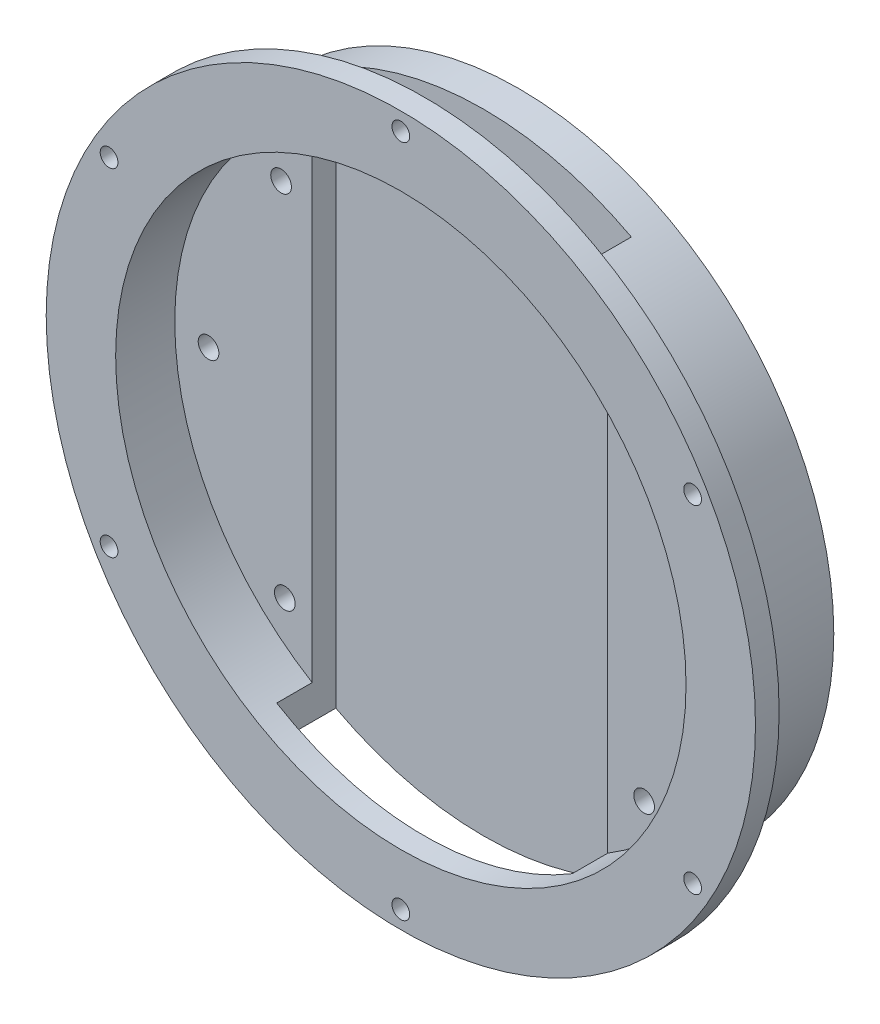
from build123d import *

# Parameters (mm, degrees)
SKETCH_1_R               = 1.75
EXTRUDE_1_DEPTH          = 15
EXTRUDE_1_2_DEPTH        = 15
EXTRUDE_1_3_DEPTH        = 15
EXTRUDE_1_4_DEPTH        = 15
EXTRUDE_1_5_DEPTH        = 15
EXTRUDE_1_6_DEPTH        = 15
EXTRUDE_1_7_DEPTH        = 15
EXTRUDE_1_8_DEPTH        = 15
SKETCH_2_R               = 48.25
EXTRUDE_2_DEPTH          = 5
EXTRUDE_START            = -15
SKETCH_3_R               = 53.25
SKETCH_3_R_2             = 48.25
EXTRUDE_1_9_DEPTH        = 15
SKETCH_4_R               = 60
SKETCH_4_R_2             = 48.25
EXTRUDE_3_DEPTH          = 4
CUT_EXTRUDE_1_REACH      = 87.563
SKETCH_6_R               = 1.5
CUT_EXTRUDE_3_DEPTH      = 94.407708461
CUT_EXTRUDE_3_DEPTH_BACK = 94.407708461
SKETCH_9_W               = 50
SKETCH_9_H               = 10
SKETCH_10_R              = 53.25
EXTRUDE_4_DEPTH          = 5
CUT_EXTRUDE_4_DEPTH      = 89.459030065
CUT_EXTRUDE_4_DEPTH_BACK = 89.459030065
SKETCH_11_R              = 1.75


with BuildPart() as part:
    # 草图1 → Extrude 1 (new body)
    with BuildSketch(Plane.XY):
        with Locations((43.431304103, -0.032870953)):
            Circle(SKETCH_1_R)
    extrude(amount=EXTRUDE_1_DEPTH)



with BuildPart() as body_2:
    # 草图1 → Extrude 1 2 (new body)
    with BuildSketch(Plane.XY):
        with Locations((31.159786222, -30.557369002)):
            Circle(SKETCH_1_R)
    extrude(amount=EXTRUDE_1_2_DEPTH)


with BuildPart() as body_3:
    # 草图1 → Extrude 1 3 (new body)
    with BuildSketch(Plane.XY):
        with Locations((0.89843315, -43.464175056)):
            Circle(SKETCH_1_R)
    extrude(amount=EXTRUDE_1_3_DEPTH)


with BuildPart() as body_4:
    # 草图1 → Extrude 1 4 (new body)
    with BuildSketch(Plane.XY):
        with Locations((-29.626064899, -31.192657175)):
            Circle(SKETCH_1_R)
    extrude(amount=EXTRUDE_1_4_DEPTH)


with BuildPart() as body_5:
    # 草图1 → Extrude 1 5 (new body)
    with BuildSketch(Plane.XY):
        with Locations((-42.532870953, -0.931304103)):
            Circle(SKETCH_1_R)
    extrude(amount=EXTRUDE_1_5_DEPTH)


with BuildPart() as body_6:
    # 草图1 → Extrude 1 6 (new body)
    with BuildSketch(Plane.XY):
        with Locations((-30.261353072, 29.593193946)):
            Circle(SKETCH_1_R)
    extrude(amount=EXTRUDE_1_6_DEPTH)


with BuildPart() as body_7:
    # 草图1 → Extrude 1 7 (new body)
    with BuildSketch(Plane.XY):
        with Locations((0, 42.5)):
            Circle(SKETCH_1_R)
    extrude(amount=EXTRUDE_1_7_DEPTH)


with BuildPart() as body_8:
    # 草图1 → Extrude 1 8 (new body)
    with BuildSketch(Plane.XY):
        with Locations((30.524498049, 30.228482119)):
            Circle(SKETCH_1_R)
    extrude(amount=EXTRUDE_1_8_DEPTH)


with BuildPart() as part_1:
    add(part.part)

    add(body_2.part)  # 凸台-拉伸2 merges body 2

    add(body_3.part)  # 凸台-拉伸2 merges body 3

    add(body_4.part)  # 凸台-拉伸2 merges body 4

    add(body_5.part)  # 凸台-拉伸2 merges body 5

    add(body_6.part)  # 凸台-拉伸2 merges body 6

    add(body_7.part)  # 凸台-拉伸2 merges body 7

    add(body_8.part)  # 凸台-拉伸2 merges body 8
    # 草图2 → 凸台-拉伸2 (add)
    with BuildSketch(Plane.XY):
        Circle(SKETCH_2_R)
    extrude(amount=-EXTRUDE_2_DEPTH)

    # 草图3 → Extrude 1 9 (add)
    with BuildSketch(Plane(origin=(0, 0, -5), x_dir=(-1, 0, 0), z_dir=(0, 0, -1)).offset(EXTRUDE_START)):
        Circle(SKETCH_3_R)
        Circle(SKETCH_3_R_2, mode=Mode.SUBTRACT)
    extrude(amount=EXTRUDE_1_9_DEPTH)

    # 草图4 → 凸台-拉伸3 (add)
    with BuildSketch(Plane.XY.offset(10)):
        Circle(SKETCH_4_R)
        with Locations(Location((0, 0, 0), (0, 0, 180))):
            Circle(SKETCH_4_R_2, mode=Mode.SUBTRACT)
    extrude(amount=-EXTRUDE_3_DEPTH)

    # 草图6 → 切除-拉伸1 (cut, up to next)
    with BuildSketch(Plane(origin=(0, 0, 6), x_dir=(-1, 0, 0), z_dir=(0, 0, -1)), mode=Mode.PRIVATE) as cut_extrude_1_sk1:
        with Locations((0, 57)):
            Circle(SKETCH_6_R)
    cut_extrude_1_tool1 = extrude(cut_extrude_1_sk1.sketch, amount=-CUT_EXTRUDE_1_REACH, mode=Mode.PRIVATE) & part_1.part
    # 草图6 → 切除-拉伸1 (cut, up to next)
    with BuildSketch(Plane(origin=(0, 0, 6), x_dir=(-1, 0, 0), z_dir=(0, 0, -1)), mode=Mode.PRIVATE) as cut_extrude_1_sk2:
        with Locations((49.363448016, 28.5)):
            Circle(SKETCH_6_R)
    cut_extrude_1_tool2 = extrude(cut_extrude_1_sk2.sketch, amount=-CUT_EXTRUDE_1_REACH, mode=Mode.PRIVATE) & part_1.part
    # 草图6 → 切除-拉伸1 (cut, up to next)
    with BuildSketch(Plane(origin=(0, 0, 6), x_dir=(-1, 0, 0), z_dir=(0, 0, -1)), mode=Mode.PRIVATE) as cut_extrude_1_sk3:
        with Locations((49.363448016, -28.5)):
            Circle(SKETCH_6_R)
    cut_extrude_1_tool3 = extrude(cut_extrude_1_sk3.sketch, amount=-CUT_EXTRUDE_1_REACH, mode=Mode.PRIVATE) & part_1.part
    # 草图6 → 切除-拉伸1 (cut, up to next)
    with BuildSketch(Plane(origin=(0, 0, 6), x_dir=(-1, 0, 0), z_dir=(0, 0, -1)), mode=Mode.PRIVATE) as cut_extrude_1_sk4:
        with Locations((0, -57)):
            Circle(SKETCH_6_R)
    cut_extrude_1_tool4 = extrude(cut_extrude_1_sk4.sketch, amount=-CUT_EXTRUDE_1_REACH, mode=Mode.PRIVATE) & part_1.part
    # 草图6 → 切除-拉伸1 (cut, up to next)
    with BuildSketch(Plane(origin=(0, 0, 6), x_dir=(-1, 0, 0), z_dir=(0, 0, -1)), mode=Mode.PRIVATE) as cut_extrude_1_sk5:
        with Locations((-49.363448016, -28.5)):
            Circle(SKETCH_6_R)
    cut_extrude_1_tool5 = extrude(cut_extrude_1_sk5.sketch, amount=-CUT_EXTRUDE_1_REACH, mode=Mode.PRIVATE) & part_1.part
    # 草图6 → 切除-拉伸1 (cut, up to next)
    with BuildSketch(Plane(origin=(0, 0, 6), x_dir=(-1, 0, 0), z_dir=(0, 0, -1)), mode=Mode.PRIVATE) as cut_extrude_1_sk6:
        with Locations((-49.363448016, 28.5)):
            Circle(SKETCH_6_R)
    cut_extrude_1_tool6 = extrude(cut_extrude_1_sk6.sketch, amount=-CUT_EXTRUDE_1_REACH, mode=Mode.PRIVATE) & part_1.part
    add(cut_extrude_1_tool1.solids().sort_by_distance((0, 57, 6))[0], mode=Mode.SUBTRACT)
    add(cut_extrude_1_tool2.solids().sort_by_distance((-49.363448, 28.5, 6))[0], mode=Mode.SUBTRACT)
    add(cut_extrude_1_tool3.solids().sort_by_distance((-49.363448, -28.5, 6))[0], mode=Mode.SUBTRACT)
    add(cut_extrude_1_tool4.solids().sort_by_distance((0, -57, 6))[0], mode=Mode.SUBTRACT)
    add(cut_extrude_1_tool5.solids().sort_by_distance((49.363448, -28.5, 6))[0], mode=Mode.SUBTRACT)
    add(cut_extrude_1_tool6.solids().sort_by_distance((49.363448, 28.5, 6))[0], mode=Mode.SUBTRACT)

    # 草图9 → 切除-拉伸3 (cut, two sides: drawn at the far end of the back side and taken through both)
    with BuildSketch(Plane(origin=(0, 10, 0), x_dir=(1, 0, 0), z_dir=(0, 1, 0)).offset(-CUT_EXTRUDE_3_DEPTH_BACK)):
        with Locations((0, -1)):
            Rectangle(SKETCH_9_W, SKETCH_9_H)
    extrude(amount=CUT_EXTRUDE_3_DEPTH + CUT_EXTRUDE_3_DEPTH_BACK, mode=Mode.SUBTRACT)


with BuildPart() as body_2_2:
    # of the pieces the cut leaves, the one that is kept (cut_extrude_3_keep)
    add(part_1.part.solids().sort_by_distance((-25, 41.268177813, 0))[0])

    # 草图10 → 凸台-拉伸4 (add)
    with BuildSketch(Plane(origin=(0, 0, -5), x_dir=(-1, 0, 0), z_dir=(0, 0, -1))):
        Circle(SKETCH_10_R)
    extrude(amount=EXTRUDE_4_DEPTH)

    # 草图11 → 切除-拉伸4 (cut, two sides: drawn at the far end of the back side and taken through both)
    with BuildSketch(Plane(origin=(0, 0, -10), x_dir=(-1, 0, 0), z_dir=(0, 0, -1)).offset(-CUT_EXTRUDE_4_DEPTH_BACK)):
        with Locations((30.261353072, 29.593193946)):
            Circle(SKETCH_11_R)
        with Locations((42.532870953, -0.931304103)):
            Circle(SKETCH_11_R)
        with Locations((29.626064899, -31.192657175)):
            Circle(SKETCH_11_R)
        with Locations((-31.159786222, -30.557369002)):
            Circle(SKETCH_11_R)
        with Locations((-43.431304103, -0.032870953)):
            Circle(SKETCH_11_R)
        with Locations((-30.524498049, 30.228482119)):
            Circle(SKETCH_11_R)
    extrude(amount=CUT_EXTRUDE_4_DEPTH + CUT_EXTRUDE_4_DEPTH_BACK, mode=Mode.SUBTRACT)


solid = body_2_2.part
